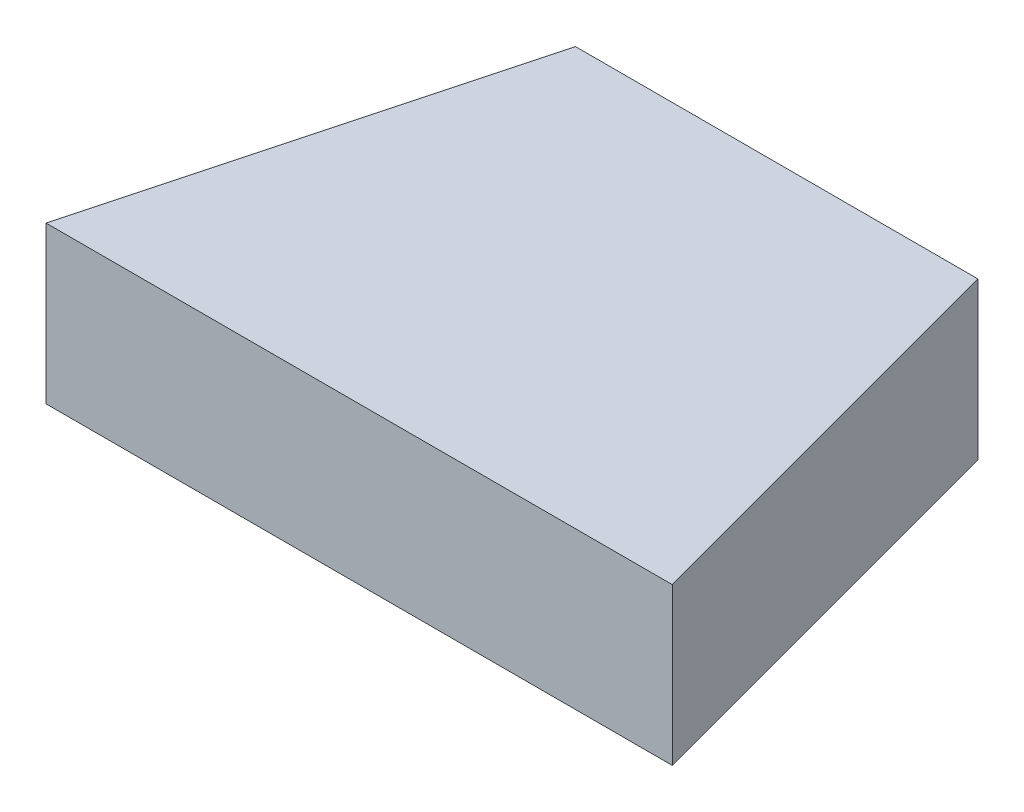
from build123d import *

# Parameters (mm, degrees)
BOSS_EXTRUDE1_DEPTH = 19.05


with BuildPart() as part:
    # Sketch1 → Boss-Extrude1 (new body)
    with BuildSketch(Plane(origin=(0, 0, 0), x_dir=(1, 0, 0), z_dir=(0, 1, 0))):
        Polygon((-38.1, -142.191135768), (38.1, -142.191135768), (24.488181024, -91.391135768), (-24.488181024, -91.391135768), align=None)
    extrude(amount=BOSS_EXTRUDE1_DEPTH)


solid = part.part
